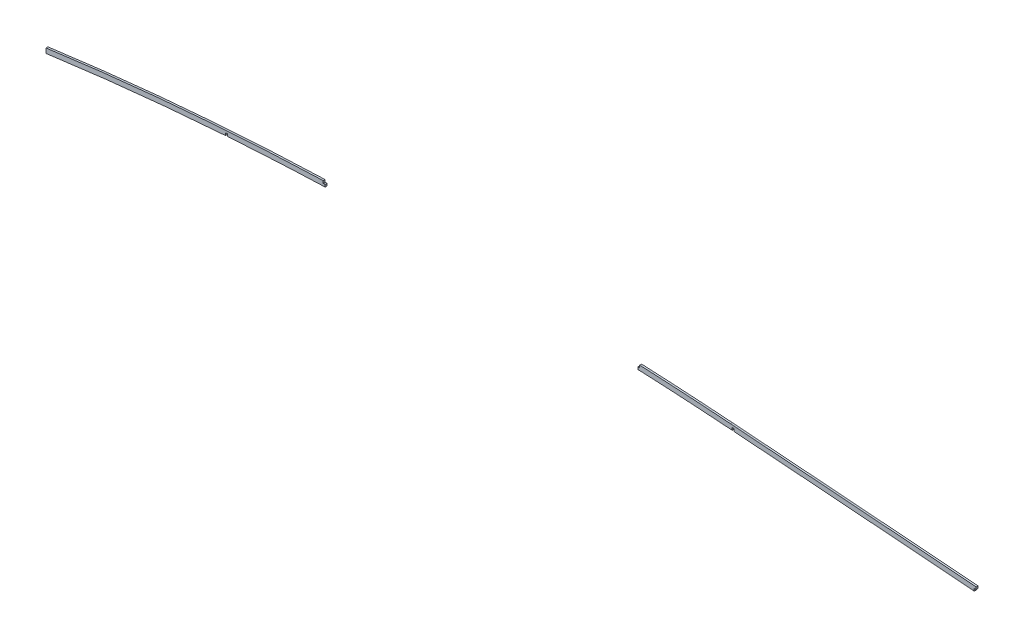
from build123d import *

# Parameters (mm, degrees)
BOSS_EXTRUDE1_DEPTH   = 10
BOSS_EXTRUDE1_2_DEPTH = 10


with BuildPart() as part:
    # Sketch1 → Boss-Extrude1 (new body)
    with BuildSketch(Plane.XY):
        with BuildLine():
            ThreePointArc((805.133639253, 360.815398634), (753.196478916, 363.374685055), (701.251734504, 365.775122282))
            Line((701.251734504, 365.775122282), (701.251734504, 353.250144955))
            Line((701.251734504, 353.250144955), (691.251734504, 353.250144955))
            Line((691.251734504, 353.250144955), (691.251734504, 340.750144955))
            Line((691.251734504, 340.750144955), (701.251734504, 340.750144955))
            ThreePointArc((701.251734504, 340.750144955), (752.562093664, 338.376486624), (803.865036814, 335.847606424))
            ThreePointArc((803.865036814, 335.847606424), (991.712012091, 325.259367188), (1179.430120773, 312.590168174))
            ThreePointArc((1179.430120773, 312.590168174), (1185.340125552, 312.158324881), (1191.250120775, 311.726350832))
            Line((1191.250120775, 311.726350832), (1191.250120775, 324.226350832))
            Line((1191.250120775, 324.226350832), (1201.250120775, 324.226350832))
            Line((1201.250120775, 324.226350832), (1201.250120775, 310.99513029))
            ThreePointArc((1201.250120775, 310.99513029), (1837.221006456, 263.718414373), (2473.077522104, 214.927566772))
            Line((2473.077522104, 214.927566772), (2473.077522104, 226.686009709))
            Line((2473.077522104, 226.686009709), (2483.077522104, 226.686009709))
            Line((2483.077522104, 226.686009709), (2483.077522104, 239.223942192))
            ThreePointArc((2483.077522104, 239.223942192), (1832.224516513, 289.16695334), (1181.251734504, 337.52371432))
            ThreePointArc((1181.251734504, 337.52371432), (993.257215053, 350.211568449), (805.133639253, 360.815398634))
        make_face()
    extrude(amount=BOSS_EXTRUDE1_DEPTH)


with BuildPart() as body_2:
    # Sketch1 → Boss-Extrude1 2 (new body)
    with BuildSketch(Plane.XY):
        with BuildLine():
            Line((-975.006665926, 361.586251126), (-975.006665926, 374.101140921))
            ThreePointArc((-975.006665926, 374.101140921), (-1710.835170262, 329.982333834), (-2443.472345252, 248.540165679))
            Line((-2443.472345252, 248.540165679), (-2443.472345252, 223.306348579))
            ThreePointArc((-2443.472345252, 223.306348579), (-1968.723868859, 280.476468865), (-1492.346665926, 321.940899607))
            Line((-1492.346665926, 321.940899607), (-1492.346665926, 335.141693375))
            Line((-1492.346665926, 335.141693375), (-1482.346665926, 335.141693375))
            Line((-1482.346665926, 335.141693375), (-1482.346665926, 322.641693375))
            ThreePointArc((-1482.346665926, 322.641693375), (-1228.792641889, 338.088976188), (-975.006665926, 349.086251126))
            Line((-975.006665926, 349.086251126), (-965.006665926, 349.086251126))
            Line((-965.006665926, 349.086251126), (-965.006665926, 361.586251126))
            Line((-965.006665926, 361.586251126), (-975.006665926, 361.586251126))
        make_face()
    extrude(amount=BOSS_EXTRUDE1_2_DEPTH)


solid = Compound([part.part, body_2.part])
